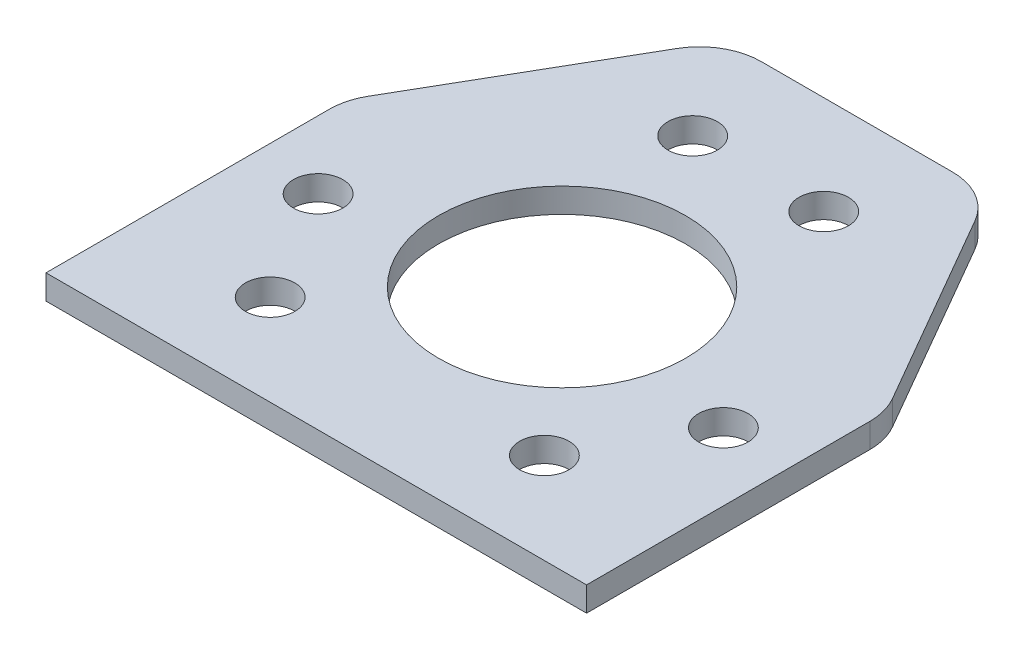
from build123d import *

# Parameters (mm, degrees)
SKETCH10_R           = 8
BOSS_EXTRUDE2_DEPTH  = 1.5875
M3_CLEARANCE_HOLE1_D = 3.2
FILLET2_R            = 4


with BuildPart() as part:
    # Sketch10 → Boss-Extrude2 (new body)
    with BuildSketch(Plane(origin=(0, 0, 0), x_dir=(1, 0, 0), z_dir=(0, 1, 0))):
        Polygon((8.5, 19.085417438), (-8.5, 19.085417438), (-17.5, 3.49696017), (-17.5, -15.914582562), (17.5, -15.914582562), (17.5, 3.49696017), align=None)
        Circle(SKETCH10_R, mode=Mode.SUBTRACT)
    extrude(amount=BOSS_EXTRUDE2_DEPTH)

    # M3 Clearance Hole1 (through all)
    with Locations(Plane(origin=(0, 1.5875, 0), x_dir=(1, 0, 0), z_dir=(0, 1, 0))):
        with Locations((-8.877202285, -10.024234614), (-13.119842972, -2.675765386), (-4.242640687, 12.7), (4.242640687, 12.7), (13.119842972, -2.675765386), (8.877202285, -10.024234614)):
            Hole(M3_CLEARANCE_HOLE1_D / 2)

    # Fillet2
    fillet2_edges = [part.edges().sort_by_distance(p)[0] for p in [
        (-17.5, 0.79375, -3.49696017),
        (-8.5, 0.79375, -19.085417438),
        (17.5, 0.79375, -3.49696017),
        (8.5, 0.79375, -19.085417438),
    ]]
    fillet(fillet2_edges, radius=FILLET2_R)


solid = part.part
